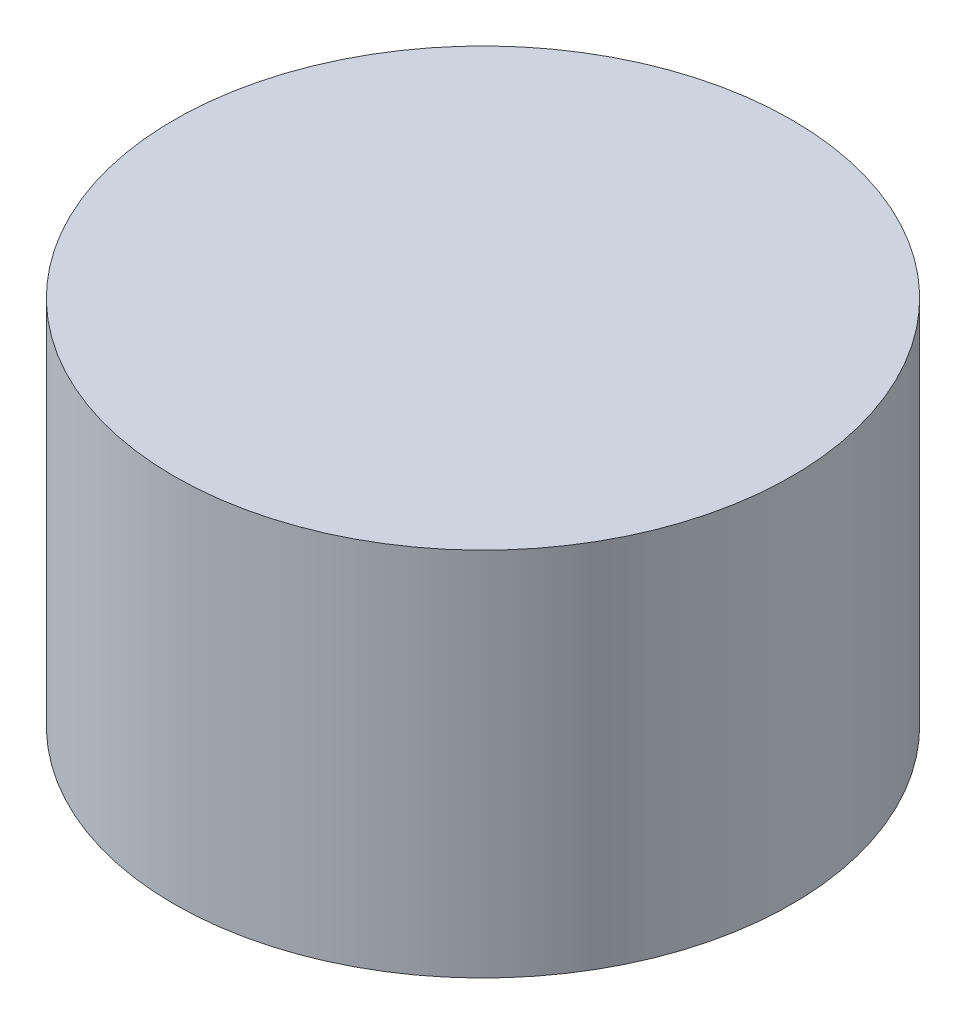
from build123d import *

# Parameters (mm, degrees)
SKETCH1_R           = 2.5
BOSS_EXTRUDE1_DEPTH = 3


with BuildPart() as part:
    # Sketch1 → Boss-Extrude1 (new body)
    with BuildSketch(Plane(origin=(0, 0, 0), x_dir=(1, 0, 0), z_dir=(0, 1, 0))):
        with Locations(Location((-33.236248001, 21.43864852, 0), (0, 0, 270))):
            Circle(SKETCH1_R)
    extrude(amount=BOSS_EXTRUDE1_DEPTH)


solid = part.part
